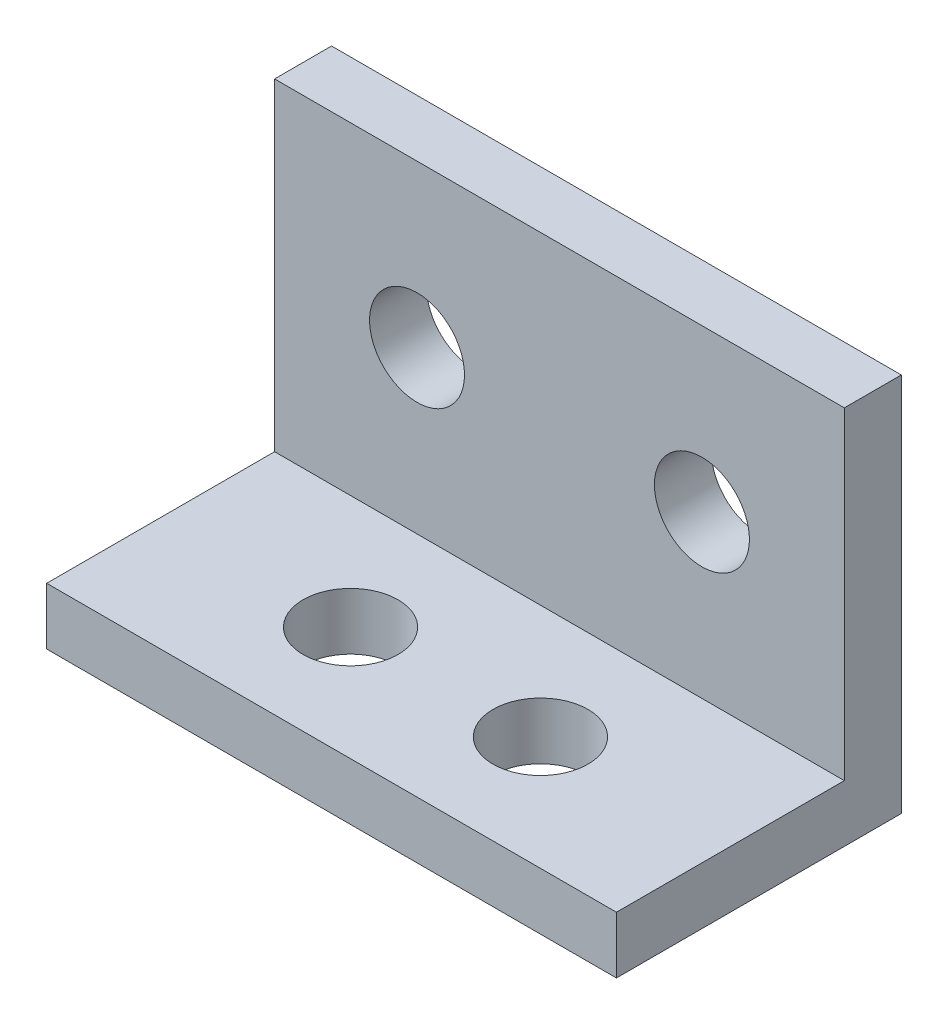
from build123d import *

# Parameters (mm, degrees)
BOSS_EXTRUDE1_DEPTH = 38.1
SKETCH3_R           = 3.175
CUT_EXTRUDE1_DEPTH  = 49.26
SKETCH4_R           = 3.175
CUT_EXTRUDE2_DEPTH  = 25.4


with BuildPart() as part:
    # Sketch2 → Boss-Extrude1 (new body)
    with BuildSketch(Plane(origin=(0, 0, 0), x_dir=(0, 0, -1), z_dir=(1, 0, 0))):
        Polygon((0, 0), (-19.05, 0), (-19.05, 3.81), (-3.81, 3.81), (-3.81, 25.4), (0, 25.4), align=None)
    extrude(amount=BOSS_EXTRUDE1_DEPTH)

    # Sketch3 → Cut-Extrude1 (cut, through all)
    with BuildSketch(Plane.XY.offset(3.81)):
        with Locations((9.525, 14.605)):
            Circle(SKETCH3_R)
        with Locations(Location((28.575, 14.605, 0), (0, 0, 180))):
            Circle(SKETCH3_R)
    extrude(amount=-CUT_EXTRUDE1_DEPTH, mode=Mode.SUBTRACT)

    # Sketch4 → Cut-Extrude2 (cut)
    with BuildSketch(Plane(origin=(0, 0, 0), x_dir=(-1, 0, 0), z_dir=(0, -1, 0))):
        with Locations(Location((-12.7, -11.43, 0), (0, 0, 90))):
            Circle(SKETCH4_R)
        with Locations(Location((-25.4, -11.43, 0), (0, 0, 90))):
            Circle(SKETCH4_R)
    extrude(amount=-CUT_EXTRUDE2_DEPTH, mode=Mode.SUBTRACT)


solid = part.part
